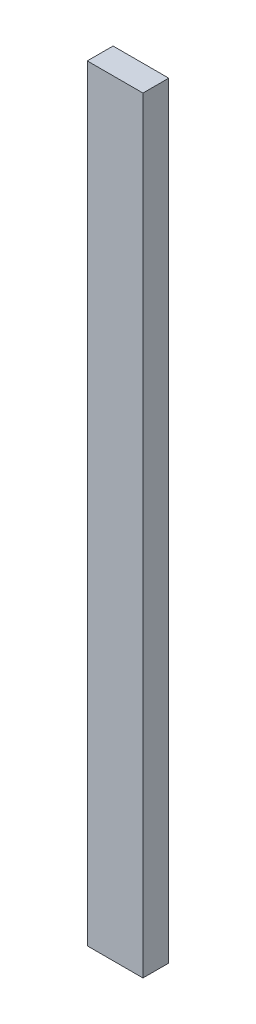
from build123d import *

# Parameters (mm, degrees)
SKETCH1_W               = 2.159
SKETCH1_H               = 29.718
COMPONENT_OUTLINE_DEPTH = 1


with BuildPart() as part:
    # Sketch1 → Component_Outline (new body)
    with BuildSketch(Plane.XY):
        with Locations((0.1905, 0)):
            Rectangle(SKETCH1_W, SKETCH1_H)
    extrude(amount=COMPONENT_OUTLINE_DEPTH)


solid = part.part
